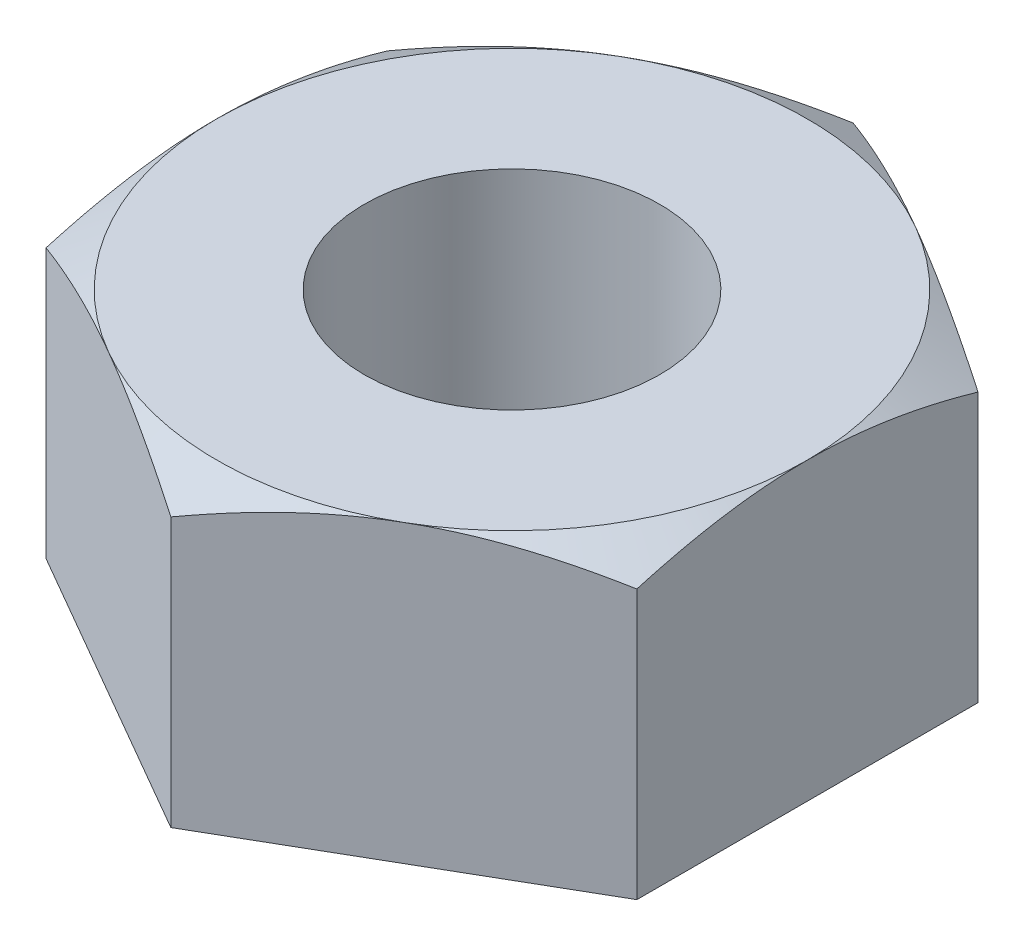
from build123d import *

# Parameters (mm, degrees)
BOSS_EXTRUDE1_DEPTH = 5
TAPPED_HOLE1_D      = 5


with BuildPart() as part:
    # Sketch1 → Boss-Extrude1 (new body)
    with BuildSketch(Plane(origin=(0, 0, 0), x_dir=(1, 0, 0), z_dir=(0, 1, 0))):
        Polygon((0, 5.773502692), (-5, 2.886751346), (-5, -2.886751346), (0, -5.773502692), (5, -2.886751346), (5, 2.886751346), align=None)
    extrude(amount=-BOSS_EXTRUDE1_DEPTH)

    # Sketch2 → Cut-Revolve1 (revolve, cut)
    with BuildSketch(Plane(origin=(0, 0, 0), x_dir=(0, 0, -1), z_dir=(1, 0, 0))):
        Polygon((5, 0), (5.773502692, 0), (5.773502692, -0.446581987), align=None)
    revolve(axis=Axis((0, 0, 0), (0, -1, 0)), mode=Mode.SUBTRACT)

    # Tapped Hole1 (through all)
    with Locations(Plane(origin=(0, 0, 0), x_dir=(1, 0, 0), z_dir=(0, 1, 0))):
        with Locations((0, 0)):
            Hole(TAPPED_HOLE1_D / 2)


solid = part.part
